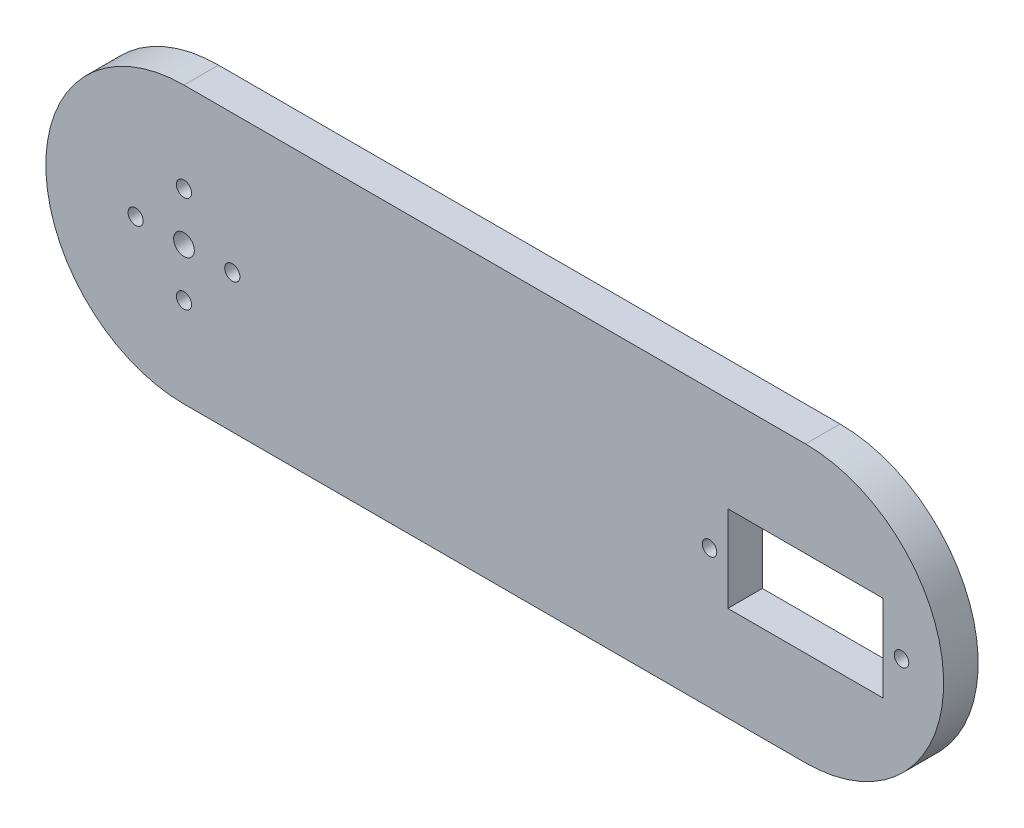
from build123d import *

# Parameters (mm, degrees)
BOSS_EXTRUDE1_DEPTH   = 5
CUT_EXTRUDE1_REACH    = 113.915
SKETCH2_R             = 1.5
SKETCH2_R_2           = 1.1
BODY_MOVE_COPY1_ANGLE = 90
SKETCH19_R            = 1.05
SKETCH19_W            = 22.5
SKETCH19_H            = 12.5
CUT_EXTRUDE9_DEPTH    = 112.915146428


with BuildPart() as part:
    # Sketch1 → Boss-Extrude1 (new body)
    with BuildSketch(Plane(origin=(0, 0, 0), x_dir=(1, 0, 0), z_dir=(0, 1, 0))):
        with BuildLine():
            Line((90, -20), (0, -20))
            ThreePointArc((0, -20), (-20, 0), (0, 20))
            Line((0, 20), (90, 20))
            ThreePointArc((90, 20), (110, 0), (90, -20))
        make_face()
    extrude(amount=BOSS_EXTRUDE1_DEPTH)

    # Sketch2 → Cut-Extrude1 (cut, up to next)
    with BuildSketch(Plane(origin=(0, 5, 0), x_dir=(1, 0, 0), z_dir=(0, 1, 0)), mode=Mode.PRIVATE) as cut_extrude1_sk1:
        with Locations(Location((0, 0, 0), (0, 0, 270))):
            Circle(SKETCH2_R)
    cut_extrude1_tool1 = extrude(cut_extrude1_sk1.sketch, amount=-CUT_EXTRUDE1_REACH, mode=Mode.PRIVATE) & part.part
    # Sketch2 → Cut-Extrude1 (cut, up to next)
    with BuildSketch(Plane(origin=(0, 5, 0), x_dir=(1, 0, 0), z_dir=(0, 1, 0)), mode=Mode.PRIVATE) as cut_extrude1_sk2:
        with Locations(Location((0, 7, 0), (0, 0, 270))):
            Circle(SKETCH2_R_2)
    cut_extrude1_tool2 = extrude(cut_extrude1_sk2.sketch, amount=-CUT_EXTRUDE1_REACH, mode=Mode.PRIVATE) & part.part
    # Sketch2 → Cut-Extrude1 (cut, up to next)
    with BuildSketch(Plane(origin=(0, 5, 0), x_dir=(1, 0, 0), z_dir=(0, 1, 0)), mode=Mode.PRIVATE) as cut_extrude1_sk3:
        with Locations(Location((7.001, 0.001, 0), (0, 0, 270))):
            Circle(SKETCH2_R_2)
    cut_extrude1_tool3 = extrude(cut_extrude1_sk3.sketch, amount=-CUT_EXTRUDE1_REACH, mode=Mode.PRIVATE) & part.part
    # Sketch2 → Cut-Extrude1 (cut, up to next)
    with BuildSketch(Plane(origin=(0, 5, 0), x_dir=(1, 0, 0), z_dir=(0, 1, 0)), mode=Mode.PRIVATE) as cut_extrude1_sk4:
        with Locations(Location((0.002, -7, 0), (0, 0, 270))):
            Circle(SKETCH2_R_2)
    cut_extrude1_tool4 = extrude(cut_extrude1_sk4.sketch, amount=-CUT_EXTRUDE1_REACH, mode=Mode.PRIVATE) & part.part
    # Sketch2 → Cut-Extrude1 (cut, up to next)
    with BuildSketch(Plane(origin=(0, 5, 0), x_dir=(1, 0, 0), z_dir=(0, 1, 0)), mode=Mode.PRIVATE) as cut_extrude1_sk5:
        with Locations(Location((-6.999, -0.001, 0), (0, 0, 270))):
            Circle(SKETCH2_R_2)
    cut_extrude1_tool5 = extrude(cut_extrude1_sk5.sketch, amount=-CUT_EXTRUDE1_REACH, mode=Mode.PRIVATE) & part.part
    add(cut_extrude1_tool1.solids().sort_by_distance((0, 5, 0))[0], mode=Mode.SUBTRACT)
    add(cut_extrude1_tool2.solids().sort_by_distance((0, 5, -7))[0], mode=Mode.SUBTRACT)
    add(cut_extrude1_tool3.solids().sort_by_distance((7.001, 5, -0.001))[0], mode=Mode.SUBTRACT)
    add(cut_extrude1_tool4.solids().sort_by_distance((0.002, 5, 7))[0], mode=Mode.SUBTRACT)
    add(cut_extrude1_tool5.solids().sort_by_distance((-6.999, 5, 0.001))[0], mode=Mode.SUBTRACT)


with BuildPart() as part_1:
    # Body-Move/Copy1: moved
    add(part.part.rotate(Axis((0, 0, 0), (1, 0, 0)), BODY_MOVE_COPY1_ANGLE))

    # Sketch19 → Cut-Extrude9 (cut, through all)
    with BuildSketch(Plane.XY.offset(5)):
        with Locations((103.9, 0)):
            Circle(SKETCH19_R)
        with Locations(Location((76.1, 0, 0), (0, 0, 180))):
            Circle(SKETCH19_R)
        with Locations((90, 0)):
            Rectangle(SKETCH19_W, SKETCH19_H)
    extrude(amount=-CUT_EXTRUDE9_DEPTH, mode=Mode.SUBTRACT)


with BuildPart() as part_2:
    # Body-Move/Copy2: moved
    add(part_1.part.moved(Location((0, 0, -5))))


solid = part_2.part
